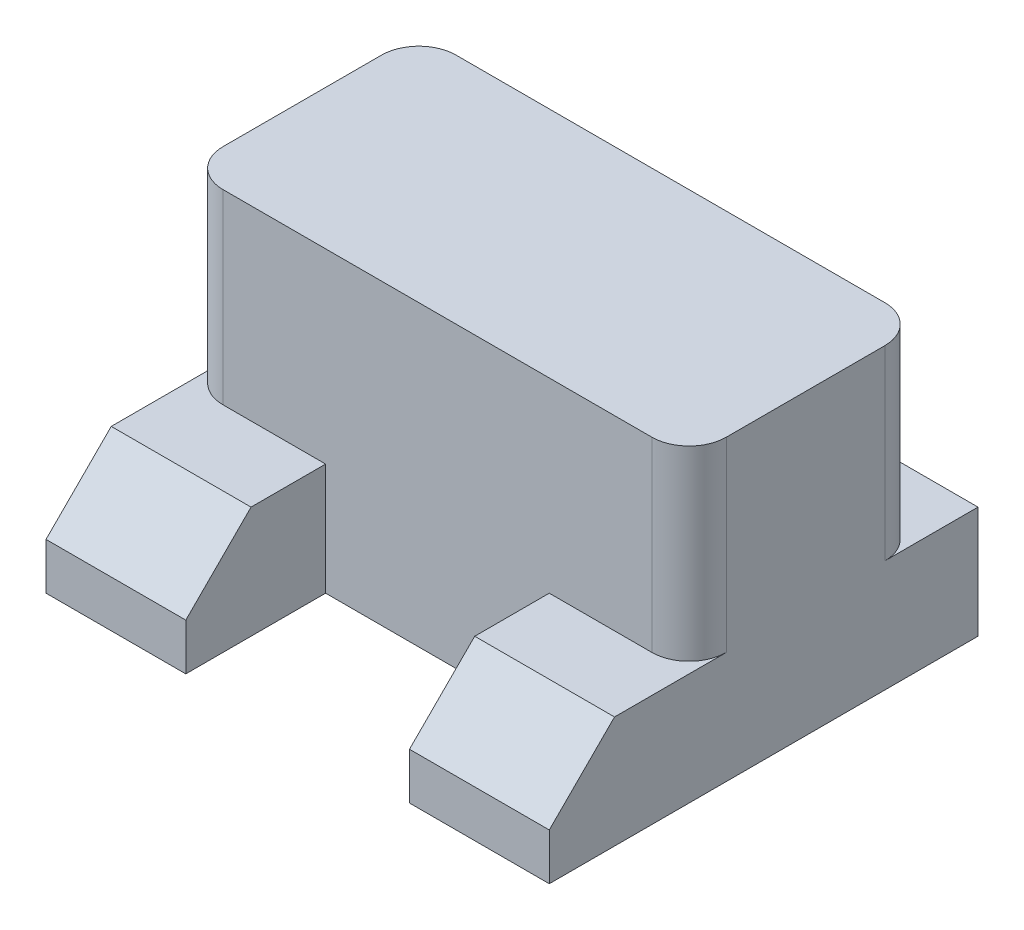
from build123d import *

# Parameters (mm, degrees)
EXTRUDE_3_DEPTH      = 2
EXTRUDE_3_DEPTH_BACK = 1.2
SKETCH_2_W           = 5.4
SKETCH_2_H           = 2.5
EXTRUDE_4_DEPTH      = 1.2
SKETCH_5_W           = 4
SKETCH_5_H           = 1.5
EXTRUDE_7_DEPTH      = 0.5
SKETCH_6_W           = 1.5
SKETCH_6_H           = 1.2
EXTRUDE_8_DEPTH      = 0.6
SKETCH_7_W           = 1.5
SKETCH_7_H           = 1.2
EXTRUDE_9_DEPTH      = 1.5
CHAMFER_2_SIZE       = 0.7


with BuildPart() as part:
    # 草图1 → 凸台-拉伸3 (new, two sides: drawn at the far end of the back side and taken through both)
    with BuildSketch(Plane(origin=(0, 0, 0), x_dir=(1, 0, 0), z_dir=(0, 1, 0)).offset(-EXTRUDE_3_DEPTH_BACK)):
        with BuildLine():
            Line((-2.7, 0.85), (-2.7, -0.85))
            ThreePointArc((-2.7, -0.85), (-2.582842712, -1.132842712), (-2.3, -1.25))
            Line((-2.3, -1.25), (2.3, -1.25))
            ThreePointArc((2.3, -1.25), (2.582842712, -1.132842712), (2.7, -0.85))
            Line((2.7, -0.85), (2.7, 0.85))
            ThreePointArc((2.7, 0.85), (2.582842712, 1.132842712), (2.3, 1.25))
            Line((2.3, 1.25), (-2.3, 1.25))
            ThreePointArc((-2.3, 1.25), (-2.582842712, 1.132842712), (-2.7, 0.85))
        make_face()
    extrude(amount=EXTRUDE_3_DEPTH + EXTRUDE_3_DEPTH_BACK)

    # 草图2 → 凸台-拉伸4 (add)
    with BuildSketch(Plane(origin=(0, 0, 0), x_dir=(1, 0, 0), z_dir=(0, 1, 0))):
        Rectangle(SKETCH_2_W, SKETCH_2_H)
    extrude(amount=-EXTRUDE_4_DEPTH)

    # 草图5 → 凸台-拉伸7 (add)
    with BuildSketch(Plane(origin=(0, -1.2, 0), x_dir=(-1, 0, 0), z_dir=(0, -1, 0))):
        with Locations((0, 0.15)):
            Rectangle(SKETCH_5_W, SKETCH_5_H)
    extrude(amount=EXTRUDE_7_DEPTH)

    # 草图6 → 凸台-拉伸8 (add)
    with BuildSketch(Plane(origin=(0, 0, -1.25), x_dir=(-1, 0, 0), z_dir=(0, 0, -1))):
        with Locations((1.95, -0.6)):
            Rectangle(SKETCH_6_W, SKETCH_6_H)
        with Locations((-1.95, -0.6)):
            Rectangle(SKETCH_6_W, SKETCH_6_H)
    extrude(amount=EXTRUDE_8_DEPTH)

    # 草图7 → 凸台-拉伸9 (add)
    with BuildSketch(Plane.XY.offset(1.25)):
        with Locations((1.95, -0.6)):
            Rectangle(SKETCH_7_W, SKETCH_7_H)
        with Locations((-1.95, -0.6)):
            Rectangle(SKETCH_7_W, SKETCH_7_H)
    extrude(amount=EXTRUDE_9_DEPTH)

    # 倒角2
    chamfer_2_edges = [part.edges().sort_by_distance(p)[0] for p in [
        (1.95, 0, 2.75),
        (-1.95, 0, 2.75),
    ]]
    chamfer(chamfer_2_edges, length=CHAMFER_2_SIZE)


solid = part.part
